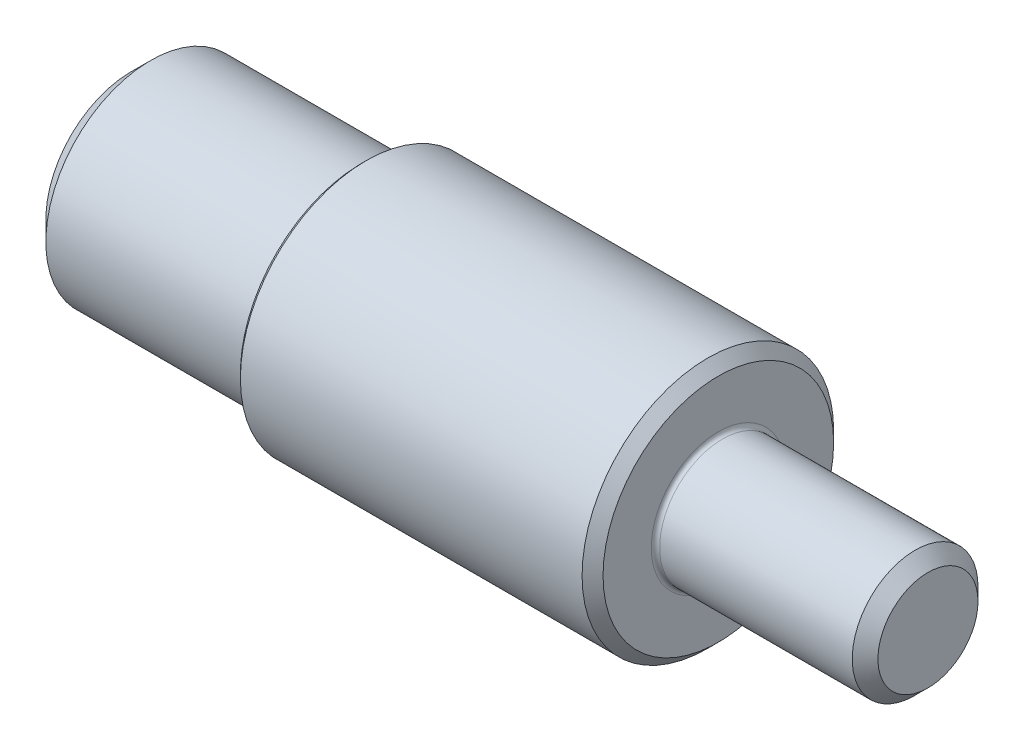
from build123d import *


with BuildPart() as part:
    # Sketch1 → Revolve1 (revolve)
    with BuildSketch(Plane.XY, mode=Mode.PRIVATE) as revolve1_sk:
        with BuildLine():
            Line((-11, 4.08), (-11, 0))
            Line((-11, 0), (27, 0))
            Line((27, 0), (27, 2.3865))
            Line((27, 2.3865), (26.3865, 3))
            Line((26.3865, 3), (17.2, 3))
            ThreePointArc((17.2, 3), (17.058578644, 3.058578644), (17, 3.2))
            Line((17, 3.2), (17, 5.5))
            Line((17, 5.5), (16.5, 6))
            Line((16.5, 6), (0.2, 6))
            Line((0.2, 6), (0, 5.8))
            Line((0, 5.8), (0, 5.2))
            ThreePointArc((0, 5.2), (-0.058578644, 5.058578644), (-0.2, 5))
            Line((-0.2, 5), (-10.08, 5))
            Line((-10.08, 5), (-11, 4.08))
        make_face()
    revolve(revolve1_sk.sketch.rotate(Axis((-11, 0, 0), (1, 0, 0)), 270), axis=Axis((-11, 0, 0), (1, 0, 0)))


solid = part.part
